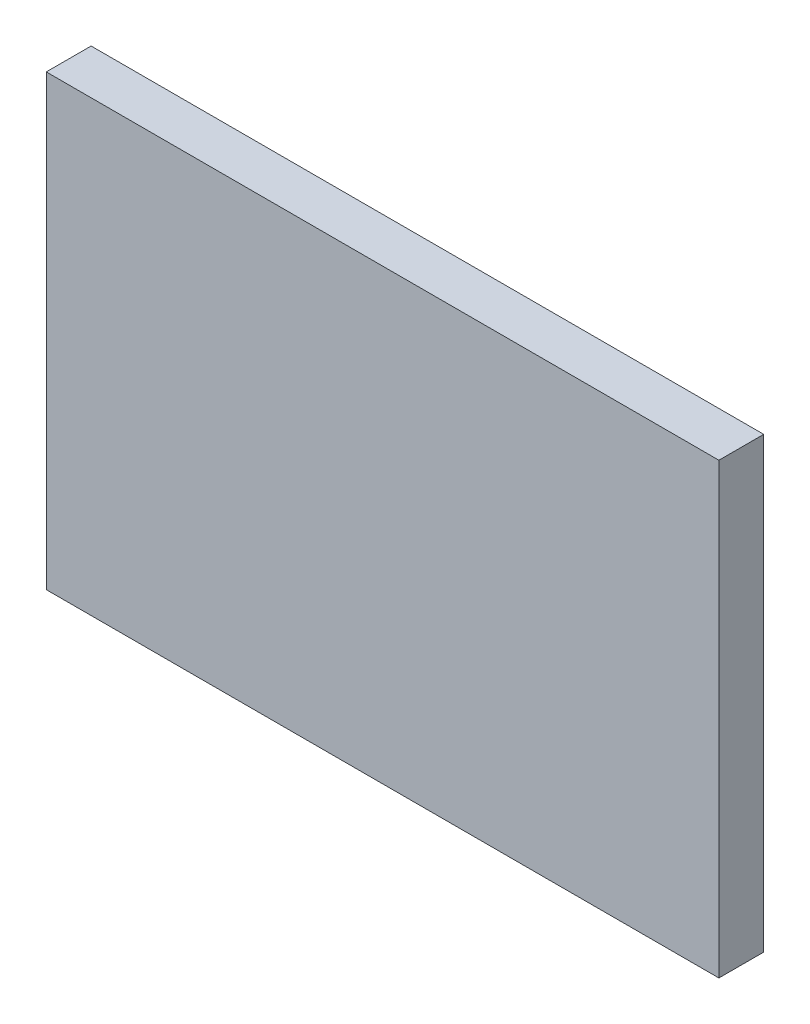
from build123d import *

# Parameters (mm, degrees)
SKETCH1_W           = 90
SKETCH1_H           = 60
BOSS_EXTRUDE1_DEPTH = 6


with BuildPart() as part:
    # Sketch1 → Boss-Extrude1 (new body)
    with BuildSketch(Plane.XY):
        Rectangle(SKETCH1_W, SKETCH1_H)
    extrude(amount=BOSS_EXTRUDE1_DEPTH)


solid = part.part
